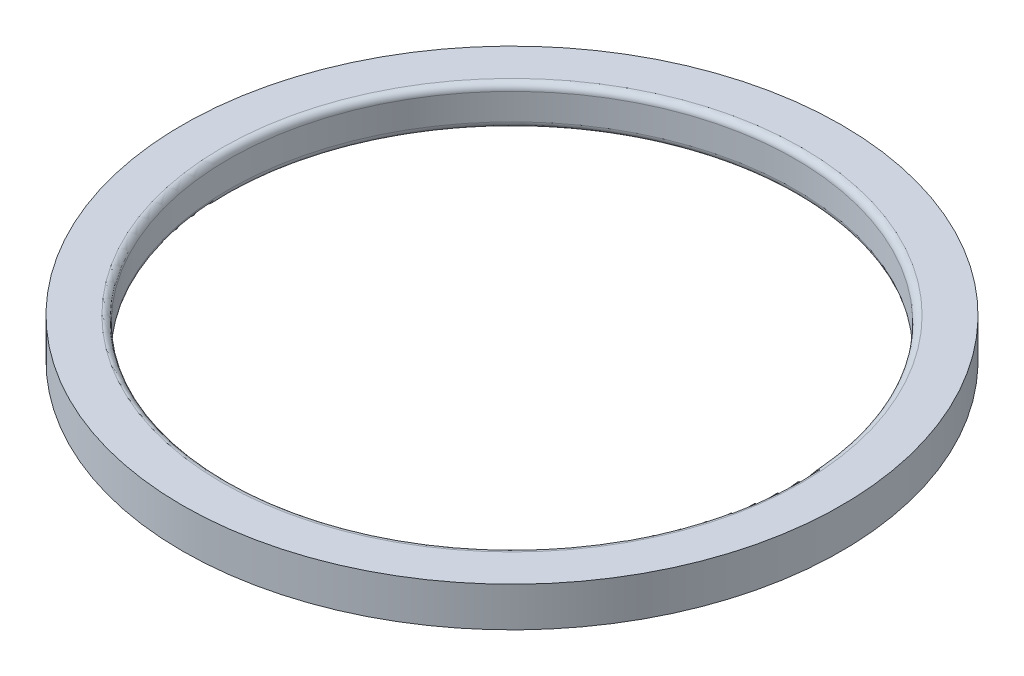
from build123d import *

# Parameters (mm, degrees)
SKETCH1_R           = 50
SKETCH1_R_2         = 43
BOSS_EXTRUDE1_DEPTH = 6
FILLET1_R           = 1


with BuildPart() as part:
    # Sketch1 → Boss-Extrude1 (new body)
    with BuildSketch(Plane(origin=(0, 0, 0), x_dir=(1, 0, 0), z_dir=(0, 1, 0))):
        with Locations(Location((0, 0, 0), (0, 0, 270))):
            Circle(SKETCH1_R)
        with Locations(Location((0, 0, 0), (0, 0, 270))):
            Circle(SKETCH1_R_2, mode=Mode.SUBTRACT)
    extrude(amount=BOSS_EXTRUDE1_DEPTH)

    # Fillet1
    fillet1_edges = [part.edges().sort_by_distance(p)[0] for p in [
        (0, 0, -43),
        (0, 6, -43),
    ]]
    fillet(fillet1_edges, radius=FILLET1_R)


solid = part.part
